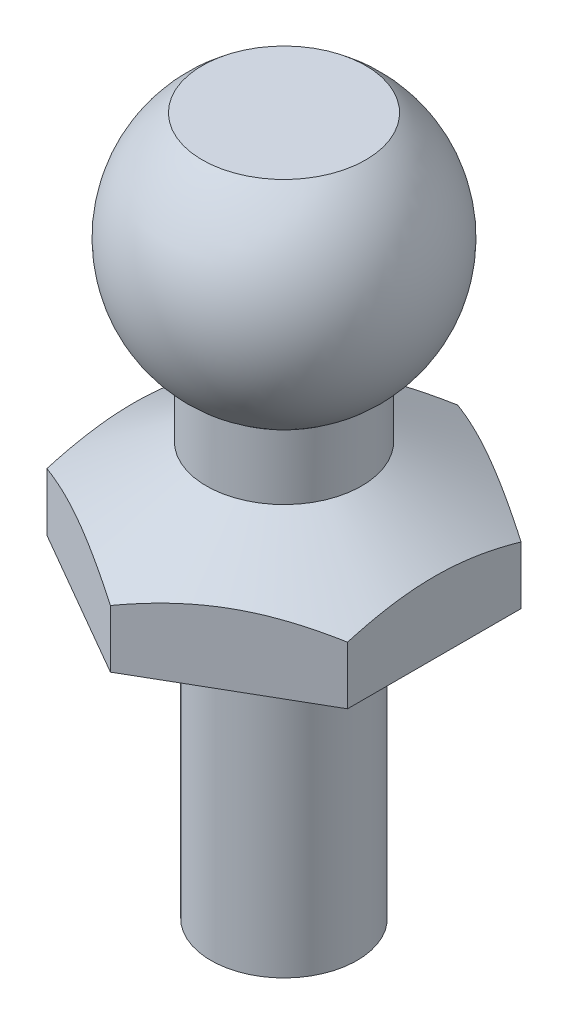
from build123d import *

# Parameters (mm, degrees)
SKETCH2_OUTSIDE_W   = 13.154
SKETCH2_OUTSIDE_H   = 13.154
CUT_EXTRUDE1_DEPTH  = 9.580601773
SKETCH3_R           = 1.1303
BOSS_EXTRUDE1_DEPTH = 4.64


with BuildPart() as part:
    # Sketch1 → Revolve1 (revolve)
    with BuildSketch(Plane.XY, mode=Mode.PRIVATE) as revolve1_sk:
        with BuildLine():
            Line((4.231088913, 0), (1.2, 1.75))
            Line((1.2, 1.75), (1.2, 2.75))
            ThreePointArc((1.2, 2.75), (2.099622467, 4.433550528), (1.26447926, 6.15))
            Line((1.26447926, 6.15), (0, 6.15))
            Line((0, 6.15), (0, 0))
            Line((0, 0), (4.231088913, 0))
        make_face()
    revolve(revolve1_sk.sketch.rotate(Axis((0, 0, 0), (0, 1, 0)), 90), axis=Axis((0, 0, 0), (0, 1, 0)))

    # Sketch2 outside → Cut-Extrude1 (cut, through all)
    with BuildSketch(Plane.XZ):
        Rectangle(SKETCH2_OUTSIDE_W, SKETCH2_OUTSIDE_H)
        Polygon((0, 2.684678752), (-2.325, 1.342339376), (-2.325, -1.342339376), (0, -2.684678752), (2.325, -1.342339376), (2.325, 1.342339376), align=None, mode=Mode.SUBTRACT)
    extrude(amount=-CUT_EXTRUDE1_DEPTH, mode=Mode.SUBTRACT)

    # Sketch3 → Boss-Extrude1 (add)
    with BuildSketch(Plane.XZ):
        with Locations(Location((0, 0, 0), (0, 0, 270))):
            Circle(SKETCH3_R)
    extrude(amount=BOSS_EXTRUDE1_DEPTH)


solid = part.part
